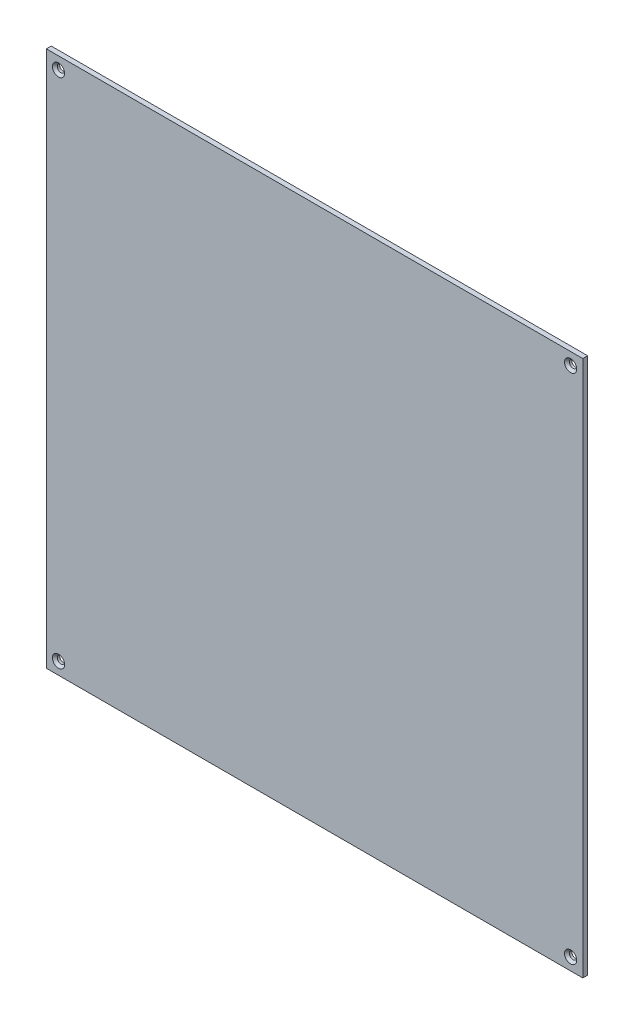
from build123d import *

# Parameters (mm, degrees)
SKETCH1_W           = 220
SKETCH1_H           = 220
SKETCH1_R           = 1.5
BOSS_EXTRUDE1_DEPTH = 2
CHAMFER1_SIZE       = 1


with BuildPart() as part:
    # Sketch1 → Boss-Extrude1 (new body)
    with BuildSketch(Plane.XY):
        Rectangle(SKETCH1_W, SKETCH1_H)
        with Locations((-105, 105)):
            Circle(SKETCH1_R, mode=Mode.SUBTRACT)
        with Locations((105, 105)):
            Circle(SKETCH1_R, mode=Mode.SUBTRACT)
        with Locations((105, -105)):
            Circle(SKETCH1_R, mode=Mode.SUBTRACT)
        with Locations((-105, -105)):
            Circle(SKETCH1_R, mode=Mode.SUBTRACT)
    extrude(amount=BOSS_EXTRUDE1_DEPTH)

    # Chamfer1
    chamfer1_edges = [part.edges().sort_by_distance(p)[0] for p in [
        (-106.5, 105, 2),
        (103.5, 105, 2),
        (103.5, -105, 2),
        (-106.5, -105, 2),
    ]]
    chamfer(chamfer1_edges, length=CHAMFER1_SIZE)


solid = part.part
